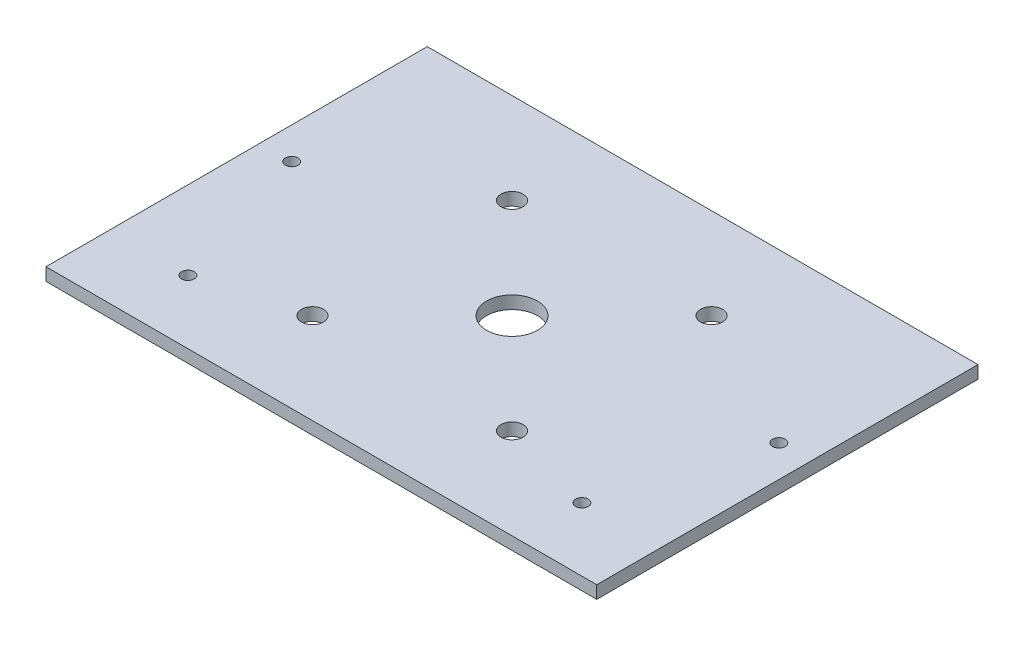
from build123d import *

# Parameters (mm, degrees)
SKETCH1_W           = 130
SKETCH1_H           = 90
BOSS_EXTRUDE1_DEPTH = 3
SKETCH2_R           = 2.6
CUT_EXTRUDE1_DEPTH  = 10
SKETCH3_R           = 1.5
CUT_EXTRUDE2_DEPTH  = 10
SKETCH4_R           = 6
CUT_EXTRUDE3_DEPTH  = 10


with BuildPart() as part:
    # Sketch1 → Boss-Extrude1 (new body)
    with BuildSketch(Plane(origin=(0, 0, 0), x_dir=(1, 0, 0), z_dir=(0, 1, 0))):
        Rectangle(SKETCH1_W, SKETCH1_H)
    extrude(amount=BOSS_EXTRUDE1_DEPTH)

    # Sketch2 → Cut-Extrude1 (cut)
    with BuildSketch(Plane(origin=(0, 3, 0), x_dir=(1, 0, 0), z_dir=(0, 1, 0))):
        with Locations(Location((23.55, -23.55, 0), (0, 0, 270))):
            Circle(SKETCH2_R)
        with Locations(Location((-23.55, -23.55, 0), (0, 0, 270))):
            Circle(SKETCH2_R)
        with Locations(Location((-23.55, 23.55, 0), (0, 0, 270))):
            Circle(SKETCH2_R)
        with Locations(Location((23.55, 23.55, 0), (0, 0, 270))):
            Circle(SKETCH2_R)
    extrude(amount=-CUT_EXTRUDE1_DEPTH, mode=Mode.SUBTRACT)

    # Sketch3 → Cut-Extrude2 (cut)
    with BuildSketch(Plane.XZ):
        with Locations(Location((46.5, 30, 0), (0, 0, 270))):
            Circle(SKETCH3_R)
        with Locations(Location((-46.5, 30, 0), (0, 0, 270))):
            Circle(SKETCH3_R)
        with Locations(Location((-57.5, -5.5, 0), (0, 0, 270))):
            Circle(SKETCH3_R)
        with Locations(Location((57.5, -5.5, 0), (0, 0, 270))):
            Circle(SKETCH3_R)
    extrude(amount=-CUT_EXTRUDE2_DEPTH, mode=Mode.SUBTRACT)

    # Sketch4 → Cut-Extrude3 (cut)
    with BuildSketch(Plane.XZ):
        with Locations(Location((0, 0, 0), (0, 0, 270))):
            Circle(SKETCH4_R)
    extrude(amount=-CUT_EXTRUDE3_DEPTH, mode=Mode.SUBTRACT)


solid = part.part
